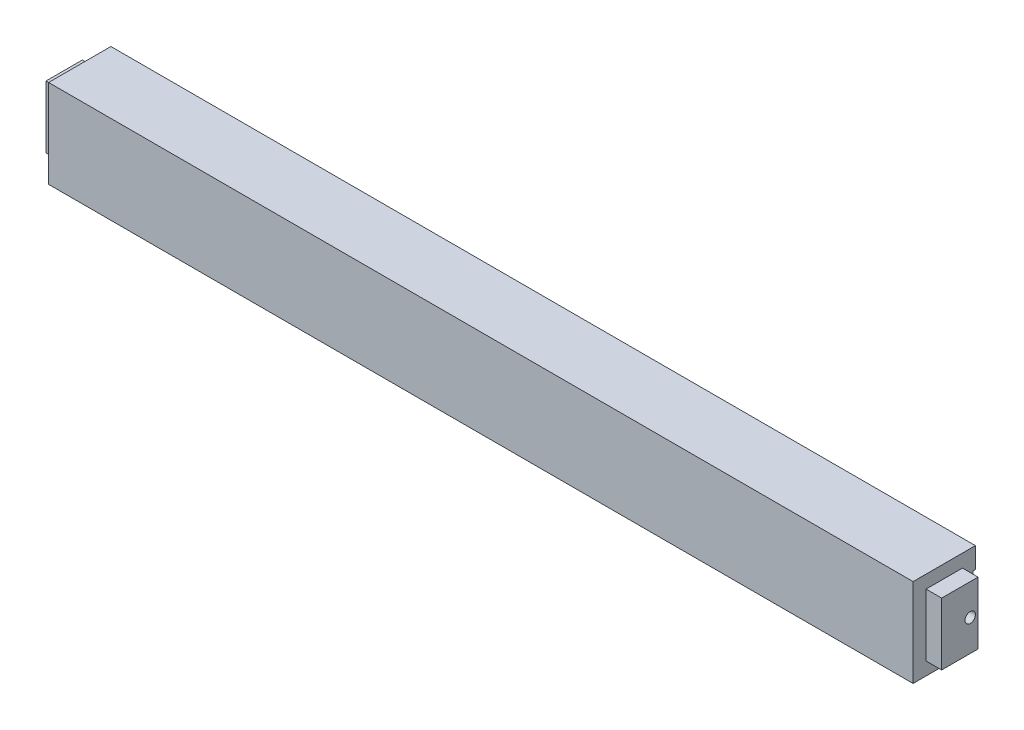
from build123d import *

# Parameters (mm, degrees)
SKETCH1_W           = 1057.275
SKETCH1_H           = 107.95
BOSS_EXTRUDE1_DEPTH = 76.2
SKETCH2_W           = 44.45
SKETCH2_H           = 76.2
BOSS_EXTRUDE2_DEPTH = 19.05
SKETCH3_R           = 6.35
CUT_EXTRUDE1_DEPTH  = 85.725
SKETCH4_W           = 3.175
SKETCH4_H           = 9.525
CUT_EXTRUDE2_DEPTH  = 1062.3906756
SKETCH5_R           = 12.7
CUT_EXTRUDE3_DEPTH  = 38.1


with BuildPart() as part:
    # Sketch1 → Boss-Extrude1 (new body)
    with BuildSketch(Plane.XY):
        Rectangle(SKETCH1_W, SKETCH1_H)
    extrude(amount=BOSS_EXTRUDE1_DEPTH)

    # Sketch2 → Boss-Extrude2 (add)
    with BuildSketch(Plane(origin=(528.6375, 0, 0), x_dir=(0, 0, -1), z_dir=(1, 0, 0))):
        with Locations((-38.1, 0)):
            Rectangle(SKETCH2_W, SKETCH2_H)
    boss_extrude2 = extrude(amount=BOSS_EXTRUDE2_DEPTH)

    # Sketch3 → Cut-Extrude1 (cut)
    with BuildSketch(Plane(origin=(547.6875, 0, 0), x_dir=(0, 0, -1), z_dir=(1, 0, 0))):
        with Locations((-25.4, 0)):
            Circle(SKETCH3_R)
    cut_extrude1 = extrude(amount=-CUT_EXTRUDE1_DEPTH, mode=Mode.SUBTRACT)

    # Sketch4 → Cut-Extrude2 (cut, through all)
    with BuildSketch(Plane(origin=(528.6375, 0, 0), x_dir=(0, 0, -1), z_dir=(1, 0, 0))):
        with Locations((-1.5875, 23.8125)):
            Rectangle(SKETCH4_W, SKETCH4_H)
    extrude(amount=-CUT_EXTRUDE2_DEPTH, mode=Mode.SUBTRACT)

    # Mirror1: Boss-Extrude2, Cut-Extrude1 across plane
    add(boss_extrude2.mirror(Plane(origin=(0, 0, 0), x_dir=(0, 0, 1), z_dir=(1, 0, 0))))
    add(cut_extrude1.mirror(Plane(origin=(0, 0, 0), x_dir=(0, 0, 1), z_dir=(1, 0, 0))), mode=Mode.SUBTRACT)

    # Sketch5 → Cut-Extrude3 (cut)
    with BuildSketch(Plane(origin=(0, 0, 0), x_dir=(-1, 0, 0), z_dir=(0, 0, -1))):
        with Locations((-461.9625, 0)):
            Circle(SKETCH5_R)
        with Locations((461.9625, 0)):
            Circle(SKETCH5_R)
    extrude(amount=-CUT_EXTRUDE3_DEPTH, mode=Mode.SUBTRACT)


solid = part.part
